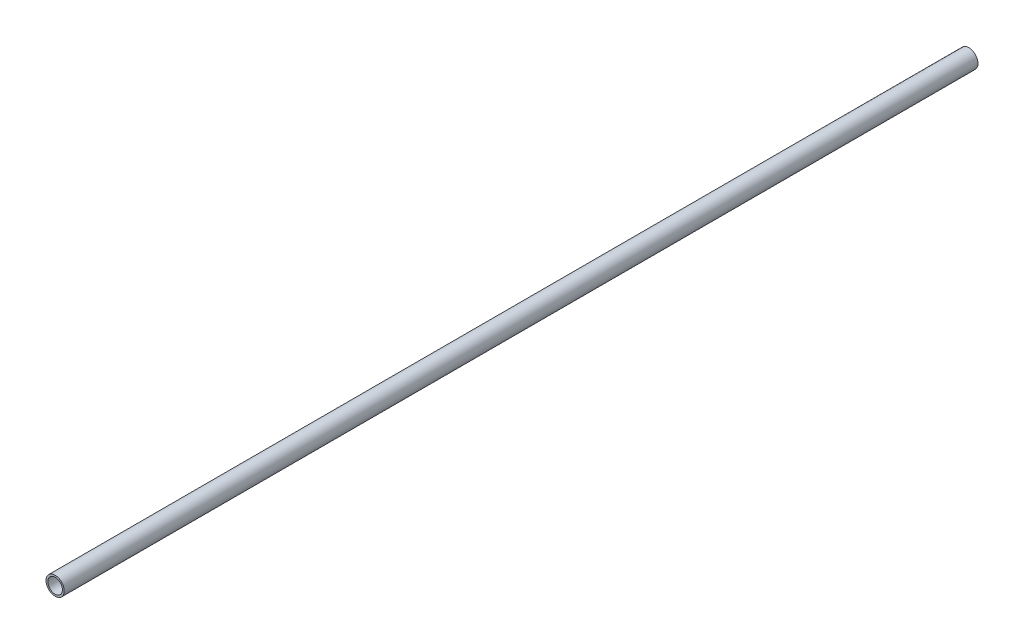
from build123d import *

# Parameters (mm, degrees)
SCHIZZO1_R                   = 10
SCHIZZO1_R_2                 = 8
ESTRUSIONE_ESTRUSIONE1_DEPTH = 1000


with BuildPart() as part:
    # Schizzo1 → Estrusione-Estrusione1 (new body)
    with BuildSketch(Plane.XY):
        Circle(SCHIZZO1_R)
        Circle(SCHIZZO1_R_2, mode=Mode.SUBTRACT)
    extrude(amount=ESTRUSIONE_ESTRUSIONE1_DEPTH)


solid = part.part
